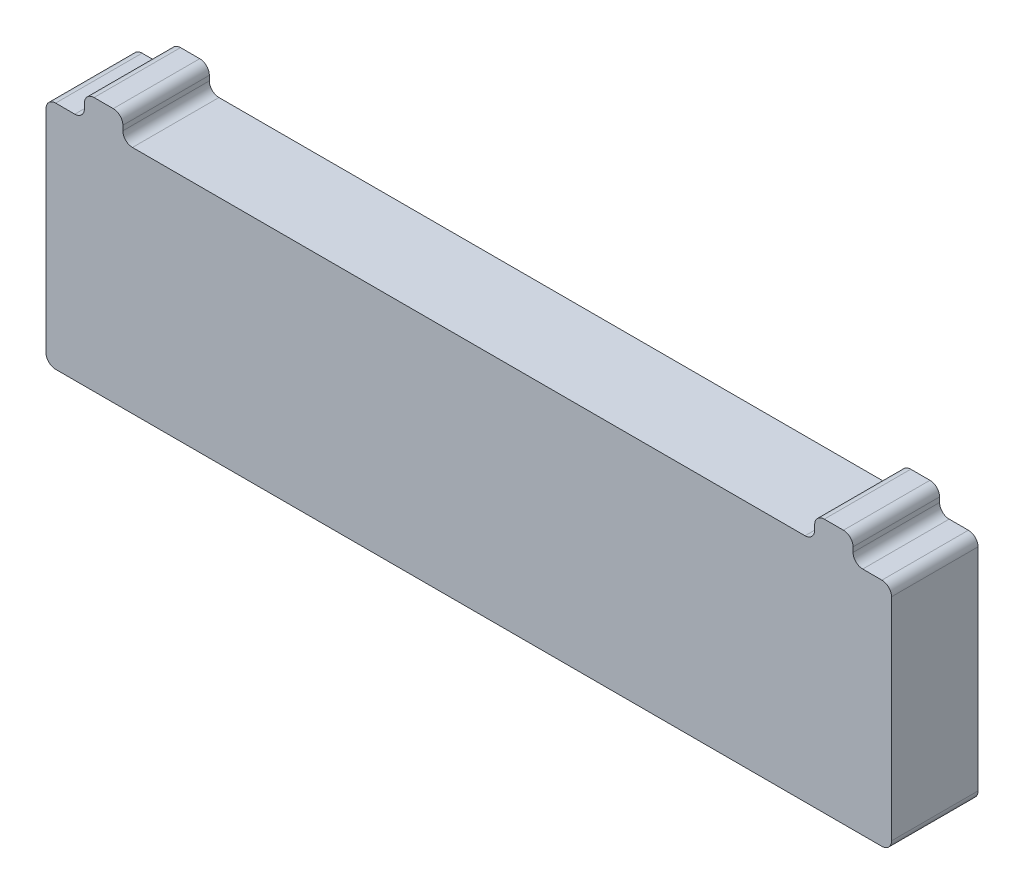
from build123d import *

# Parameters (mm, degrees)
ESQUISSE1_W        = 88
ESQUISSE1_H        = 24
BOSS_EXTRU_1_DEPTH = 9
ESQUISSE2_W        = 4
ESQUISSE2_H        = 2.5
BOSS_EXTRU_2_DEPTH = 9
CONG_1_R           = 1


with BuildPart() as part:
    # Esquisse1 → Boss.-Extru.1 (new body)
    with BuildSketch(Plane.XY):
        with Locations((0, -12)):
            Rectangle(ESQUISSE1_W, ESQUISSE1_H)
    extrude(amount=BOSS_EXTRU_1_DEPTH)

    # Esquisse2 → Boss.-Extru.2 (add)
    with BuildSketch(Plane.XY.offset(9)):
        with Locations((-38, 1.25)):
            Rectangle(ESQUISSE2_W, ESQUISSE2_H)
        with Locations((38, 1.25)):
            Rectangle(ESQUISSE2_W, ESQUISSE2_H)
    extrude(amount=-BOSS_EXTRU_2_DEPTH)

    # Congé1
    cong_1_edges = [part.edges().sort_by_distance(p)[0] for p in [
        (-40, 2.5, 4.5),
        (-40, 0, 4.5),
        (-36, 0, 4.5),
        (-36, 2.5, 4.5),
        (40, 2.5, 4.5),
        (36, 2.5, 4.5),
        (36, 0, 4.5),
        (40, 0, 4.5),
        (-44, 0, 4.5),
        (44, 0, 4.5),
        (44, -24, 4.5),
        (-44, -24, 4.5),
    ]]
    fillet(cong_1_edges, radius=CONG_1_R)


solid = part.part
